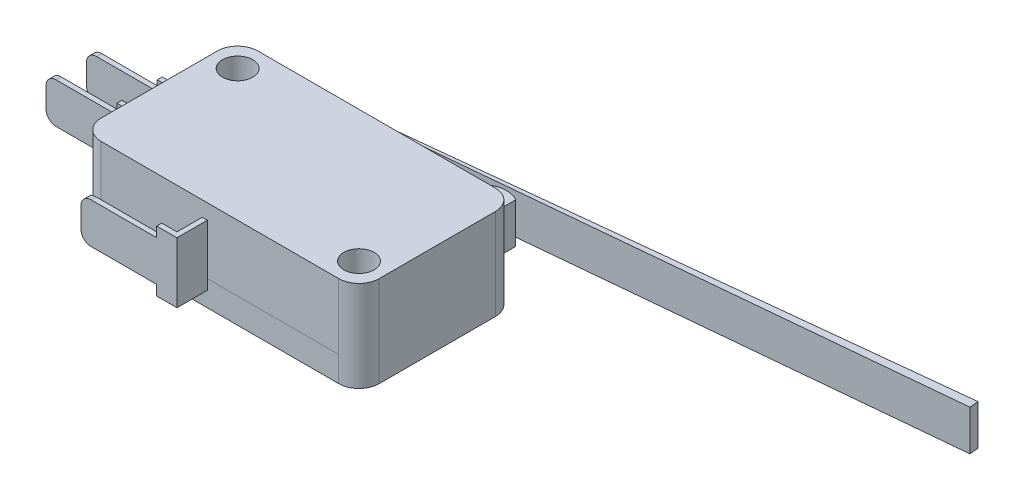
from build123d import *

# Parameters (mm, degrees)
SKETCH1_R            = 1.5
BOSS_EXTRUDE1_DEPTH  = 9
BOSS_EXTRUDE2_DEPTH  = 4
BOSS_EXTRUDE9_DEPTH  = 4
SKETCH5_W            = 9
SKETCH5_H            = 0.5
BOSS_EXTRUDE10_DEPTH = 6
SKETCH6_W            = 7.5
SKETCH6_H            = 1
CUT_EXTRUDE1_DEPTH   = 2
SKETCH7_W            = 7
SKETCH7_H            = 1
CUT_EXTRUDE2_DEPTH   = 5
FILLET1_R            = 1


with BuildPart() as part:
    # Sketch1 → Boss-Extrude1 (new body)
    with BuildSketch(Plane(origin=(0, 0, 0), x_dir=(1, 0, 0), z_dir=(0, 1, 0))):
        with BuildLine():
            Line((11.75, -7.75), (-11.75, -7.75))
            ThreePointArc((-11.75, -7.75), (-13.164213562, -7.164213562), (-13.75, -5.75))
            Line((-13.75, -5.75), (-13.75, 5.75))
            ThreePointArc((-13.75, 5.75), (-13.164213562, 7.164213562), (-11.75, 7.75))
            Line((-11.75, 7.75), (11.75, 7.75))
            ThreePointArc((11.75, 7.75), (13.164213562, 7.164213562), (13.75, 5.75))
            Line((13.75, 5.75), (13.75, -5.75))
            ThreePointArc((13.75, -5.75), (13.164213562, -7.164213562), (11.75, -7.75))
        make_face()
        with Locations(Location((-11.25, 5.25, 0), (0, 0, 270))):
            Circle(SKETCH1_R, mode=Mode.SUBTRACT)
        with Locations(Location((11.25, -5.25, 0), (0, 0, 270))):
            Circle(SKETCH1_R, mode=Mode.SUBTRACT)
    extrude(amount=BOSS_EXTRUDE1_DEPTH)

    # Sketch3 → Boss-Extrude2 (add)
    with BuildSketch(Plane(origin=(0, 2.5, 0), x_dir=(-1, 0, 0), z_dir=(0, -1, 0))):
        with BuildLine():
            Line((-11.25, 7.75), (-11.25, 10.25))
            ThreePointArc((-11.25, 10.25), (-10, 10.584936491), (-8.75, 10.25))
            Line((-8.75, 10.25), (-8.75, 7.75))
            Line((-8.75, 7.75), (-11.25, 7.75))
        make_face()
    extrude(amount=-BOSS_EXTRUDE2_DEPTH)

    # Sketch4 → Boss-Extrude9 (add)
    with BuildSketch(Plane(origin=(0, 2.5, 0), x_dir=(-1, 0, 0), z_dir=(0, -1, 0))):
        Polygon((1.75, 7.75), (2.205022523, 7.75), (2.205022523, 10.069490078), (-51.392713573, 15.829296812), (-51.47623297, 14.95318025), (1.75, 9.879171754), align=None)
    extrude(amount=-BOSS_EXTRUDE9_DEPTH)

    # Sketch5 → Boss-Extrude10 (add)
    with BuildSketch(Plane(origin=(0, 1.5, 0), x_dir=(-1, 0, 0), z_dir=(0, -1, 0))):
        Polygon((1.75, -7.75), (1.75, -10.25), (10.75, -10.25), (10.75, -10.75), (1.25, -10.75), (1.25, -7.75), align=None)
        with Locations((18.25, 2.049029433)):
            Rectangle(SKETCH5_W, SKETCH5_H)
        with Locations((18.25, -1.950970567)):
            Rectangle(SKETCH5_W, SKETCH5_H)
    extrude(amount=-BOSS_EXTRUDE10_DEPTH)

    # Sketch6 → Cut-Extrude1 (cut)
    with BuildSketch(Plane.XY.offset(10.75)):
        with Locations((-7, 2)):
            Rectangle(SKETCH6_W, SKETCH6_H)
        with Locations((-7, 7)):
            Rectangle(SKETCH6_W, SKETCH6_H)
    extrude(amount=-CUT_EXTRUDE1_DEPTH, mode=Mode.SUBTRACT)

    # Sketch7 → Cut-Extrude2 (cut)
    with BuildSketch(Plane.XY.offset(2.200970567)):
        with Locations((-19.25, 2)):
            Rectangle(SKETCH7_W, SKETCH7_H)
        with Locations((-19.25, 7)):
            Rectangle(SKETCH7_W, SKETCH7_H)
    extrude(amount=-CUT_EXTRUDE2_DEPTH, mode=Mode.SUBTRACT)

    # Fillet1
    fillet1_edges = [part.edges().sort_by_distance(p)[0] for p in [
        (-10.75, 2.5, 10.5),
        (-10.75, 6.5, 10.5),
        (-22.75, 2.5, -2.049029433),
        (-22.75, 2.5, 1.950970567),
        (-22.75, 6.5, -2.049029433),
        (-22.75, 6.5, 1.950970567),
    ]]
    fillet(fillet1_edges, radius=FILLET1_R)


solid = part.part
